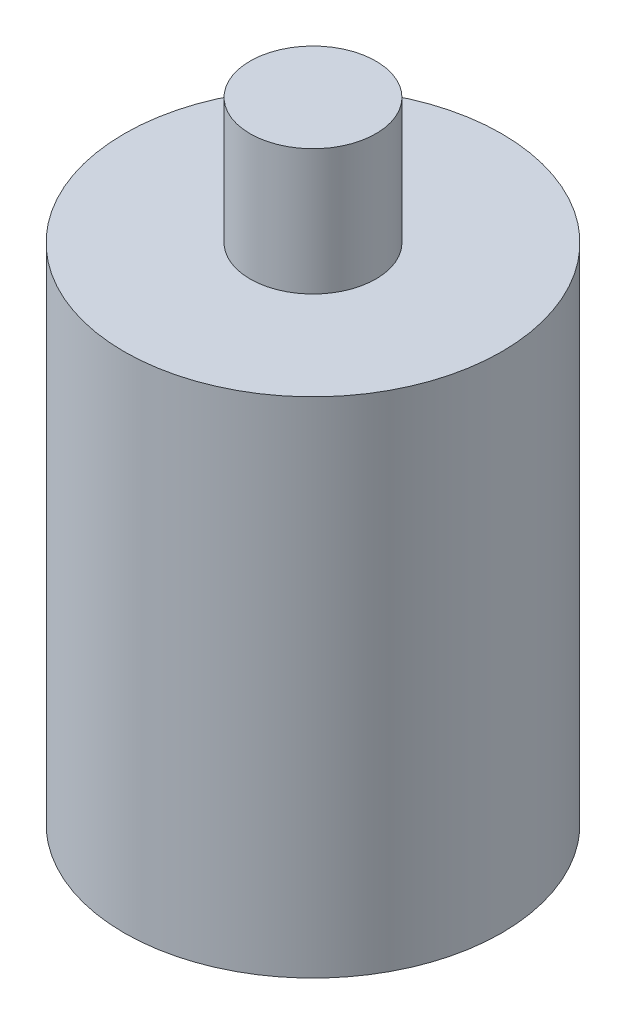
from build123d import *

# Parameters (mm, degrees)
SKETCH1_R           = 38.1
BOSS_EXTRUDE1_DEPTH = 101.6
SKETCH2_R           = 12.7
BOSS_EXTRUDE2_DEPTH = 25.4


with BuildPart() as part:
    # Sketch1 → Boss-Extrude1 (new body)
    with BuildSketch(Plane(origin=(0, 0, 0), x_dir=(1, 0, 0), z_dir=(0, 1, 0))):
        with Locations(Location((0, 0, 0), (0, 0, 270))):
            Circle(SKETCH1_R)
    extrude(amount=BOSS_EXTRUDE1_DEPTH)

    # Sketch2 → Boss-Extrude2 (add)
    with BuildSketch(Plane(origin=(0, 101.6, 0), x_dir=(1, 0, 0), z_dir=(0, 1, 0))):
        with Locations(Location((0, 0, 0), (0, 0, 270))):
            Circle(SKETCH2_R)
    extrude(amount=BOSS_EXTRUDE2_DEPTH)


solid = part.part
